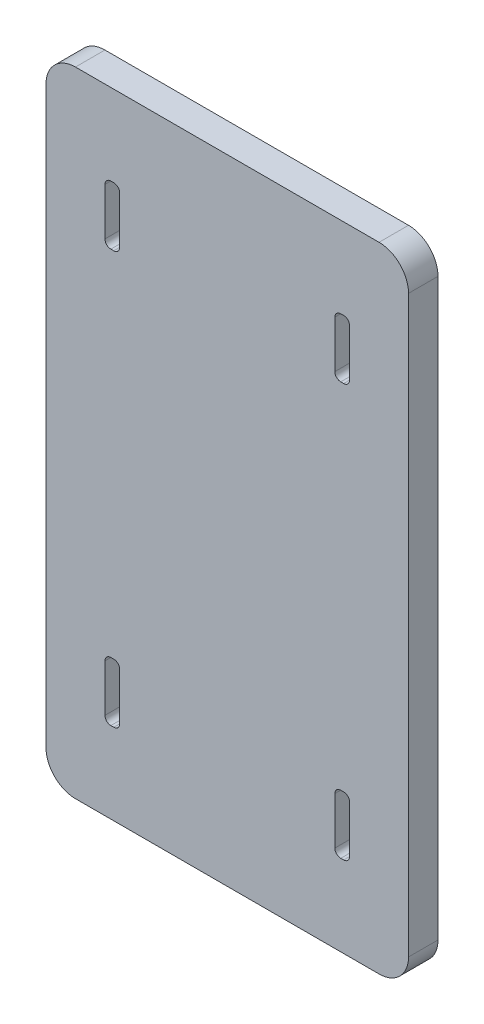
from build123d import *

# Parameters (mm, degrees)
SALIENTE_EXTRUIR1_DEPTH = 10


with BuildPart() as part:
    # Croquis2 → Saliente-Extruir1 (new body)
    with BuildSketch(Plane.XY):
        with BuildLine():
            Line((-628.214587467, 894.02140807), (-525.214587467, 894.02140807))
            ThreePointArc((-525.214587467, 894.02140807), (-518.143519656, 896.950340259), (-515.214587467, 904.02140807))
            Line((-515.214587467, 904.02140807), (-515.214587467, 1099.02140807))
            ThreePointArc((-515.214587467, 1099.02140807), (-518.143519656, 1106.092475882), (-525.214587467, 1109.02140807))
            Line((-525.214587467, 1109.02140807), (-628.214587467, 1109.02140807))
            ThreePointArc((-628.214587467, 1109.02140807), (-635.285655279, 1106.092475882), (-638.214587467, 1099.02140807))
            Line((-638.214587467, 1099.02140807), (-638.214587467, 904.02140807))
            ThreePointArc((-638.214587467, 904.02140807), (-635.285655279, 896.950340259), (-628.214587467, 894.02140807))
        make_face()
        with BuildLine():
            Line((-537.214587467, 1081.52140807), (-538.214587467, 1081.52140807))
            ThreePointArc((-538.214587467, 1081.52140807), (-539.62880103, 1080.935621633), (-540.214587467, 1079.52140807))
            Line((-540.214587467, 1079.52140807), (-540.214587467, 1063.52140807))
            ThreePointArc((-540.214587467, 1063.52140807), (-539.62880103, 1062.107194508), (-538.214587467, 1061.52140807))
            Line((-538.214587467, 1061.52140807), (-537.214587467, 1061.52140807))
            ThreePointArc((-537.214587467, 1061.52140807), (-535.800373905, 1062.107194508), (-535.214587467, 1063.52140807))
            Line((-535.214587467, 1063.52140807), (-535.214587467, 1079.52140807))
            ThreePointArc((-535.214587467, 1079.52140807), (-535.800373905, 1080.935621633), (-537.214587467, 1081.52140807))
        make_face(mode=Mode.SUBTRACT)
        with BuildLine():
            Line((-616.214587467, 1061.52140807), (-615.214587467, 1061.52140807))
            ThreePointArc((-615.214587467, 1061.52140807), (-613.800373905, 1062.107194508), (-613.214587467, 1063.52140807))
            Line((-613.214587467, 1063.52140807), (-613.214587467, 1079.52140807))
            ThreePointArc((-613.214587467, 1079.52140807), (-613.800373905, 1080.935621633), (-615.214587467, 1081.52140807))
            Line((-615.214587467, 1081.52140807), (-616.214587467, 1081.52140807))
            ThreePointArc((-616.214587467, 1081.52140807), (-617.62880103, 1080.935621633), (-618.214587467, 1079.52140807))
            Line((-618.214587467, 1079.52140807), (-618.214587467, 1063.52140807))
            ThreePointArc((-618.214587467, 1063.52140807), (-617.62880103, 1062.107194508), (-616.214587467, 1061.52140807))
        make_face(mode=Mode.SUBTRACT)
        with BuildLine():
            Line((-535.214587467, 939.52140807), (-535.214587467, 923.52140807))
            ThreePointArc((-535.214587467, 923.52140807), (-535.800373905, 922.107194508), (-537.214587467, 921.52140807))
            Line((-537.214587467, 921.52140807), (-538.214587467, 921.52140807))
            ThreePointArc((-538.214587467, 921.52140807), (-539.62880103, 922.107194508), (-540.214587467, 923.52140807))
            Line((-540.214587467, 923.52140807), (-540.214587467, 939.52140807))
            ThreePointArc((-540.214587467, 939.52140807), (-539.62880103, 940.935621633), (-538.214587467, 941.52140807))
            Line((-538.214587467, 941.52140807), (-537.214587467, 941.52140807))
            ThreePointArc((-537.214587467, 941.52140807), (-535.800373905, 940.935621633), (-535.214587467, 939.52140807))
        make_face(mode=Mode.SUBTRACT)
        with BuildLine():
            Line((-616.214587467, 921.52140807), (-615.214587467, 921.52140807))
            ThreePointArc((-615.214587467, 921.52140807), (-613.800373905, 922.107194508), (-613.214587467, 923.52140807))
            Line((-613.214587467, 923.52140807), (-613.214587467, 939.52140807))
            ThreePointArc((-613.214587467, 939.52140807), (-613.800373905, 940.935621633), (-615.214587467, 941.52140807))
            Line((-615.214587467, 941.52140807), (-616.214587467, 941.52140807))
            ThreePointArc((-616.214587467, 941.52140807), (-617.62880103, 940.935621633), (-618.214587467, 939.52140807))
            Line((-618.214587467, 939.52140807), (-618.214587467, 923.52140807))
            ThreePointArc((-618.214587467, 923.52140807), (-617.62880103, 922.107194508), (-616.214587467, 921.52140807))
        make_face(mode=Mode.SUBTRACT)
    extrude(amount=SALIENTE_EXTRUIR1_DEPTH)


solid = part.part
